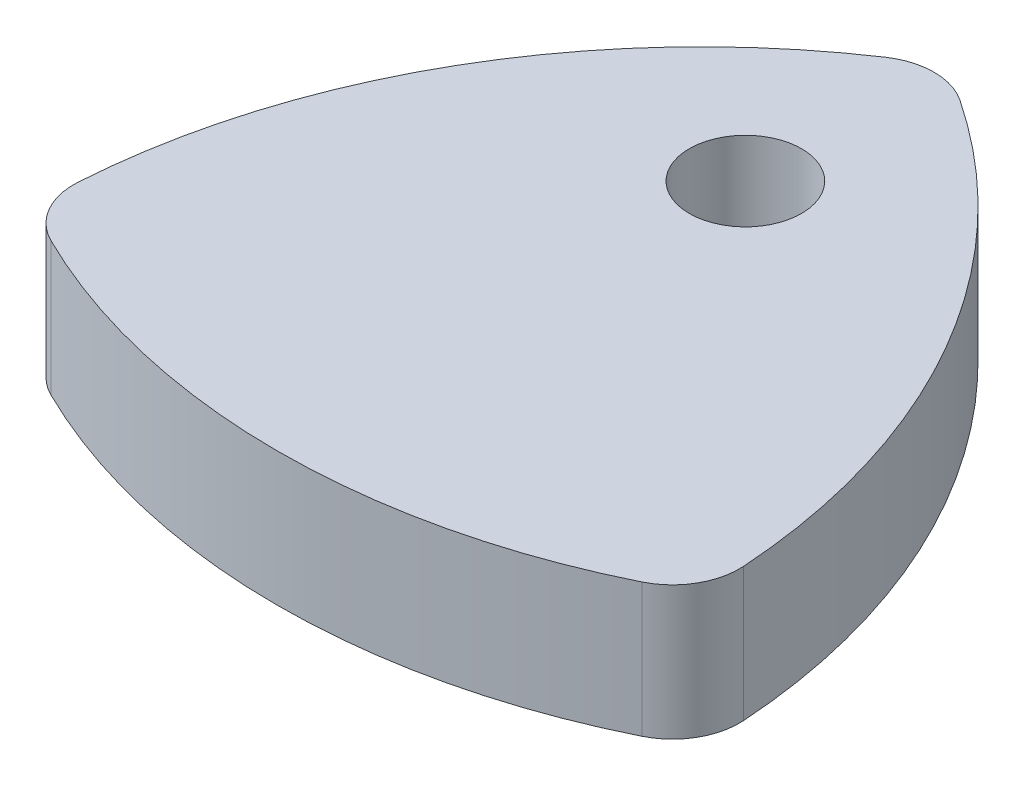
from build123d import *

# Parameters (mm, degrees)
EXTRUDE_1_DEPTH     = 10
SKETCH_2_R          = 4.2
CUT_EXTRUDE_1_DEPTH = 40.634142812
FILLET_1_R          = 5
FILLET_2_R          = 5
FILLET_3_R          = 5


with BuildPart() as part:
    # 草图1 → 凸台-拉伸1 (new body)
    with BuildSketch(Plane(origin=(0, 0, 0), x_dir=(1, 0, 0), z_dir=(0, 1, 0))):
        with BuildLine():
            ThreePointArc((-21.701095489, -19.186348515), (3.298904511, -25.885078326), (28.298904511, -19.186348515))
            ThreePointArc((28.298904511, -19.186348515), (21.6001747, 5.813651485), (3.298904511, 24.114921674))
            ThreePointArc((3.298904511, 24.114921674), (-15.002365678, 5.813651485), (-21.701095489, -19.186348515))
        make_face()
    extrude(amount=EXTRUDE_1_DEPTH)

    # 草图2 → 切除-拉伸1 (cut, through all)
    with BuildSketch(Plane(origin=(0, 10, 0), x_dir=(1, 0, 0), z_dir=(0, 1, 0))):
        with Locations(Location((3.298904511, 9.114921674, 0), (0, 0, 270))):
            Circle(SKETCH_2_R)
    extrude(amount=-CUT_EXTRUDE_1_DEPTH, mode=Mode.SUBTRACT)

    # 圆角1
    fillet_1_edges = [part.edges().sort_by_distance(p)[0] for p in [
        (3.298904511, 5, -24.114921674),
    ]]
    fillet(fillet_1_edges, radius=FILLET_1_R)

    # 圆角2
    fillet_2_edges = [part.edges().sort_by_distance(p)[0] for p in [
        (-21.701095489, 5, 19.186348515),
    ]]
    fillet(fillet_2_edges, radius=FILLET_2_R)

    # 圆角3
    fillet_3_edges = [part.edges().sort_by_distance(p)[0] for p in [
        (28.298904511, 5, 19.186348515),
    ]]
    fillet(fillet_3_edges, radius=FILLET_3_R)


solid = part.part
